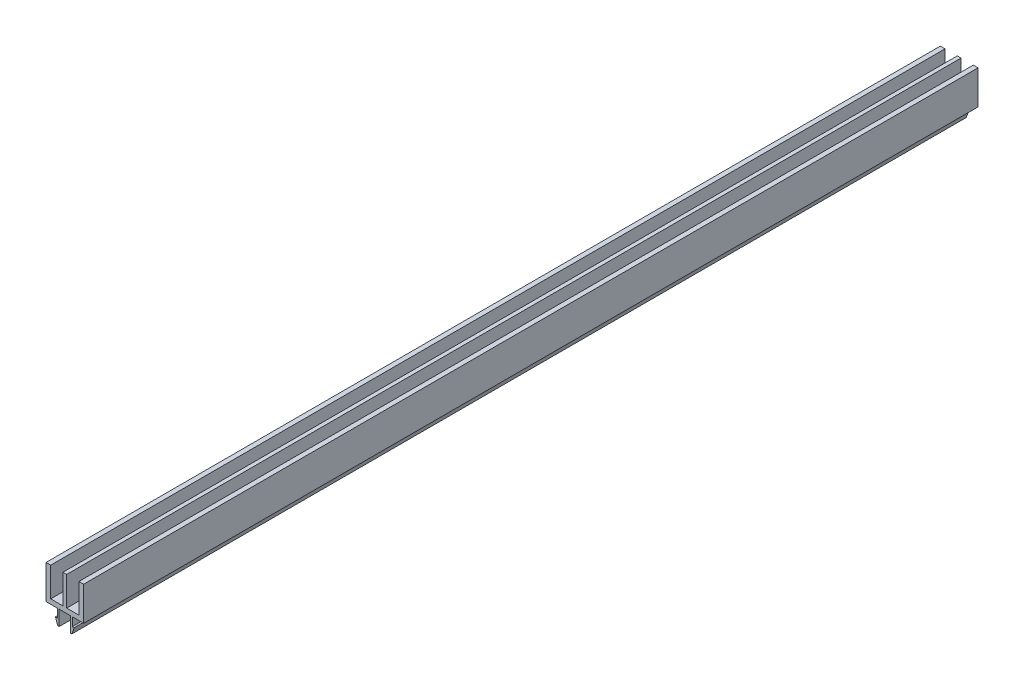
from build123d import *

# Parameters (mm, degrees)
BOSS_EXTRU_1_DEPTH = 475


with BuildPart() as part:
    # Esquisse1 → Boss.-Extru.1 (new body)
    with BuildSketch(Plane.XY.offset(50)):
        Polygon((-1, 2.5), (-7.5, 2.5), (-7.5, 17.999999998), (-10, 17.999999998), (-10, 0), (-4, 0), (-4, -4.5), (-5, -4.5), (-3.75, -8), (-3, -8), (-3, 0), (3, 0), (3, -8), (3.75, -8), (5, -4.5), (4, -4.5), (4, 0), (10, 0), (10, 17.999999998), (7.5, 17.999999998), (7.5, 2.5), (1, 2.5), (1, 17.999999998), (-1, 17.999999998), align=None)
    extrude(amount=-BOSS_EXTRU_1_DEPTH)


solid = part.part
